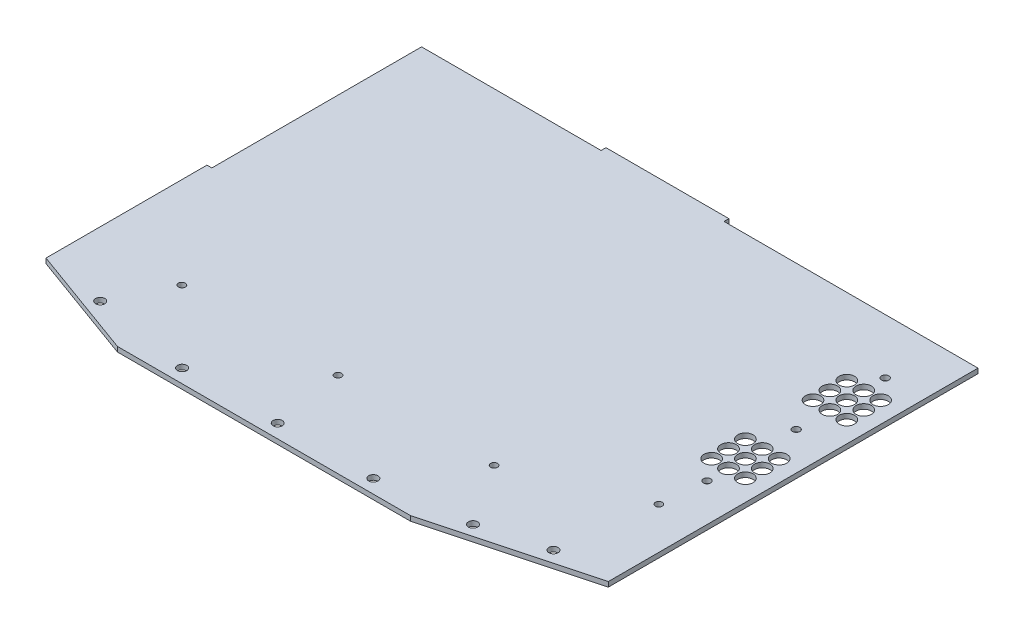
from build123d import *

# Parameters (mm, degrees)
SKETCH1_W                 = 308.11216
SKETCH1_H                 = 3.175
BOSS_EXTRUDE1_DEPTH       = 267.83
SKETCH3_W                 = 267.83
SKETCH3_H                 = 3.175
BOSS_EXTRUDE3_DEPTH       = 3.175
SKETCH4_W                 = 50.87366
SKETCH4_H                 = 3.175
BOSS_EXTRUDE4_DEPTH       = 267.83
CUT_EXTRUDE1_DEPTH        = 340.191055801
CUT_EXTRUDE3_DEPTH        = 340.191055801
SKETCH19_R                = 5
CUT_EXTRUDE5_DEPTH        = 340.191055801
LPATTERN1_COUNT           = 3
LPATTERN1_PITCH           = 11
LPATTERN2_COUNT           = 3
LPATTERN2_PITCH           = 11
LPATTERN2_COPY_1_SKETCH_R = 5
LPATTERN2_COPY_1_DEPTH    = 340.191055801
LPATTERN2_COPY_2_SKETCH_R = 5
LPATTERN2_COPY_2_DEPTH    = 340.191055801
LPATTERN2_COPY_3_SKETCH_R = 5
LPATTERN2_COPY_3_DEPTH    = 340.191055801
LPATTERN2_COPY_4_SKETCH_R = 5
LPATTERN2_COPY_4_DEPTH    = 340.191055801
LPATTERN3_COUNT           = 2
LPATTERN3_PITCH           = 66
LPATTERN3_COPY_1_SKETCH_R = 5
LPATTERN3_COPY_1_DEPTH    = 340.191055801
LPATTERN3_COPY_2_SKETCH_R = 5
LPATTERN3_COPY_2_DEPTH    = 340.191055801
LPATTERN3_COPY_3_SKETCH_R = 5
LPATTERN3_COPY_3_DEPTH    = 340.191055801
LPATTERN3_COPY_4_SKETCH_R = 5
LPATTERN3_COPY_4_DEPTH    = 340.191055801
LPATTERN3_COPY_5_SKETCH_R = 5
LPATTERN3_COPY_5_DEPTH    = 340.191055801
LPATTERN3_COPY_6_SKETCH_R = 5
LPATTERN3_COPY_6_DEPTH    = 340.191055801
LPATTERN3_COPY_7_SKETCH_R = 5
LPATTERN3_COPY_7_DEPTH    = 340.191055801
LPATTERN3_COPY_8_SKETCH_R = 5
LPATTERN3_COPY_8_DEPTH    = 340.191055801
SKETCH21_W                = 105.9343525
SKETCH21_H                = 3.175
BOSS_EXTRUDE5_DEPTH       = 3.175
CUT_EXTRUDE9_DEPTH        = 340.191055801
CUT_EXTRUDE9_DEPTH_BACK   = 340.191055801
CUT_EXTRUDE11_DEPTH       = 340.191055801
CUT_EXTRUDE11_DEPTH_BACK  = 80.645
SKETCH32_R                = 3
M4_CLEARANCE_HOLE1_D      = 4.5
SKETCH35_W                = 80
SKETCH35_H                = 3.1635
BOSS_EXTRUDE6_DEPTH       = 3.175
SKETCH36_R                = 2.4
CUT_EXTRUDE12_DEPTH       = 340.191055801
LPATTERN4_COUNT           = 3
LPATTERN4_PITCH           = 58


with BuildPart() as part:
    # Sketch1 → Boss-Extrude1 (new body)
    with BuildSketch(Plane.XY):
        Rectangle(SKETCH1_W, SKETCH1_H)
    extrude(amount=BOSS_EXTRUDE1_DEPTH)

    # Sketch3 → Boss-Extrude3 (add)
    with BuildSketch(Plane(origin=(154.05608, 0, 0), x_dir=(0, 0, -1), z_dir=(1, 0, 0))):
        with Locations((-133.915, 0)):
            Rectangle(SKETCH3_W, SKETCH3_H)
    extrude(amount=BOSS_EXTRUDE3_DEPTH)

    # Sketch4 → Boss-Extrude4 (add)
    with BuildSketch(Plane.XY.offset(267.83)):
        with Locations((182.66791, 0)):
            Rectangle(SKETCH4_W, SKETCH4_H)
    extrude(amount=-BOSS_EXTRUDE4_DEPTH)

    # Sketch6 → Cut-Extrude1 (cut, through all)
    with BuildSketch(Plane(origin=(0, 1.5875, 0), x_dir=(1, 0, 0), z_dir=(0, 1, 0))):
        Polygon((208.10474, -240.606362049), (106.50474, -267.83), (208.10474, -267.83), align=None)
    extrude(amount=-CUT_EXTRUDE1_DEPTH, mode=Mode.SUBTRACT)

    # Sketch11 → Cut-Extrude3 (cut, through all)
    with BuildSketch(Plane.XZ.offset(1.5875)):
        Polygon((-154.05608, 242.43), (-84.20608, 267.83), (-154.05608, 267.83), align=None)
    extrude(amount=-CUT_EXTRUDE3_DEPTH, mode=Mode.SUBTRACT)

    # Sketch19 → Cut-Extrude5 (cut, through all)
    with BuildSketch(Plane(origin=(0, 1.5875, 0), x_dir=(1, 0, 0), z_dir=(0, 1, 0))):
        with Locations(Location((172.48674, -49.774823778, 0), (0, 0, 270))):
            Circle(SKETCH19_R)
    cut_extrude5 = extrude(amount=-CUT_EXTRUDE5_DEPTH, mode=Mode.SUBTRACT)

    # LPattern1: Cut-Extrude5 ×3
    with Locations(*[(i * LPATTERN1_PITCH, 0, 0) for i in range(1, LPATTERN1_COUNT)]):
        add(cut_extrude5, mode=Mode.SUBTRACT)

    # LPattern2: Cut-Extrude5 ×3
    with Locations(*[(0, 0, i * LPATTERN2_PITCH) for i in range(1, LPATTERN2_COUNT)]):
        add(cut_extrude5, mode=Mode.SUBTRACT)

    # LPattern2 copy 1 sketch → LPattern2 copy 1 (cut, through all)
    with BuildSketch(Plane(origin=(11, 1.5875, 11), x_dir=(1, 0, 0), z_dir=(0, 1, 0))):
        with Locations(Location((172.48674, -49.774823778, 0), (0, 0, 270))):
            Circle(LPATTERN2_COPY_1_SKETCH_R)
    extrude(amount=-LPATTERN2_COPY_1_DEPTH, mode=Mode.SUBTRACT)

    # LPattern2 copy 2 sketch → LPattern2 copy 2 (cut, through all)
    with BuildSketch(Plane(origin=(11, 1.5875, 22), x_dir=(1, 0, 0), z_dir=(0, 1, 0))):
        with Locations(Location((172.48674, -49.774823778, 0), (0, 0, 270))):
            Circle(LPATTERN2_COPY_2_SKETCH_R)
    extrude(amount=-LPATTERN2_COPY_2_DEPTH, mode=Mode.SUBTRACT)

    # LPattern2 copy 3 sketch → LPattern2 copy 3 (cut, through all)
    with BuildSketch(Plane(origin=(22, 1.5875, 11), x_dir=(1, 0, 0), z_dir=(0, 1, 0))):
        with Locations(Location((172.48674, -49.774823778, 0), (0, 0, 270))):
            Circle(LPATTERN2_COPY_3_SKETCH_R)
    extrude(amount=-LPATTERN2_COPY_3_DEPTH, mode=Mode.SUBTRACT)

    # LPattern2 copy 4 sketch → LPattern2 copy 4 (cut, through all)
    with BuildSketch(Plane(origin=(22, 1.5875, 22), x_dir=(1, 0, 0), z_dir=(0, 1, 0))):
        with Locations(Location((172.48674, -49.774823778, 0), (0, 0, 270))):
            Circle(LPATTERN2_COPY_4_SKETCH_R)
    extrude(amount=-LPATTERN2_COPY_4_DEPTH, mode=Mode.SUBTRACT)

    # LPattern3: Cut-Extrude5 ×2
    with Locations(*[(0, 0, i * LPATTERN3_PITCH) for i in range(1, LPATTERN3_COUNT)]):
        add(cut_extrude5, mode=Mode.SUBTRACT)

    # LPattern3 copy 1 sketch → LPattern3 copy 1 (cut, through all)
    with BuildSketch(Plane(origin=(11, 1.5875, 66), x_dir=(1, 0, 0), z_dir=(0, 1, 0))):
        with Locations(Location((172.48674, -49.774823778, 0), (0, 0, 270))):
            Circle(LPATTERN3_COPY_1_SKETCH_R)
    extrude(amount=-LPATTERN3_COPY_1_DEPTH, mode=Mode.SUBTRACT)

    # LPattern3 copy 2 sketch → LPattern3 copy 2 (cut, through all)
    with BuildSketch(Plane(origin=(22, 1.5875, 66), x_dir=(1, 0, 0), z_dir=(0, 1, 0))):
        with Locations(Location((172.48674, -49.774823778, 0), (0, 0, 270))):
            Circle(LPATTERN3_COPY_2_SKETCH_R)
    extrude(amount=-LPATTERN3_COPY_2_DEPTH, mode=Mode.SUBTRACT)

    # LPattern3 copy 3 sketch → LPattern3 copy 3 (cut, through all)
    with BuildSketch(Plane(origin=(0, 1.5875, 77), x_dir=(1, 0, 0), z_dir=(0, 1, 0))):
        with Locations(Location((172.48674, -49.774823778, 0), (0, 0, 270))):
            Circle(LPATTERN3_COPY_3_SKETCH_R)
    extrude(amount=-LPATTERN3_COPY_3_DEPTH, mode=Mode.SUBTRACT)

    # LPattern3 copy 4 sketch → LPattern3 copy 4 (cut, through all)
    with BuildSketch(Plane(origin=(0, 1.5875, 88), x_dir=(1, 0, 0), z_dir=(0, 1, 0))):
        with Locations(Location((172.48674, -49.774823778, 0), (0, 0, 270))):
            Circle(LPATTERN3_COPY_4_SKETCH_R)
    extrude(amount=-LPATTERN3_COPY_4_DEPTH, mode=Mode.SUBTRACT)

    # LPattern3 copy 5 sketch → LPattern3 copy 5 (cut, through all)
    with BuildSketch(Plane(origin=(11, 1.5875, 77), x_dir=(1, 0, 0), z_dir=(0, 1, 0))):
        with Locations(Location((172.48674, -49.774823778, 0), (0, 0, 270))):
            Circle(LPATTERN3_COPY_5_SKETCH_R)
    extrude(amount=-LPATTERN3_COPY_5_DEPTH, mode=Mode.SUBTRACT)

    # LPattern3 copy 6 sketch → LPattern3 copy 6 (cut, through all)
    with BuildSketch(Plane(origin=(11, 1.5875, 88), x_dir=(1, 0, 0), z_dir=(0, 1, 0))):
        with Locations(Location((172.48674, -49.774823778, 0), (0, 0, 270))):
            Circle(LPATTERN3_COPY_6_SKETCH_R)
    extrude(amount=-LPATTERN3_COPY_6_DEPTH, mode=Mode.SUBTRACT)

    # LPattern3 copy 7 sketch → LPattern3 copy 7 (cut, through all)
    with BuildSketch(Plane(origin=(22, 1.5875, 77), x_dir=(1, 0, 0), z_dir=(0, 1, 0))):
        with Locations(Location((172.48674, -49.774823778, 0), (0, 0, 270))):
            Circle(LPATTERN3_COPY_7_SKETCH_R)
    extrude(amount=-LPATTERN3_COPY_7_DEPTH, mode=Mode.SUBTRACT)

    # LPattern3 copy 8 sketch → LPattern3 copy 8 (cut, through all)
    with BuildSketch(Plane(origin=(22, 1.5875, 88), x_dir=(1, 0, 0), z_dir=(0, 1, 0))):
        with Locations(Location((172.48674, -49.774823778, 0), (0, 0, 270))):
            Circle(LPATTERN3_COPY_8_SKETCH_R)
    extrude(amount=-LPATTERN3_COPY_8_DEPTH, mode=Mode.SUBTRACT)

    # Sketch21 → Boss-Extrude5 (add)
    with BuildSketch(Plane.ZY.offset(154.05608)):
        with Locations((189.46282375, 0)):
            Rectangle(SKETCH21_W, SKETCH21_H)
    extrude(amount=BOSS_EXTRUDE5_DEPTH)

    # Sketch27 → Cut-Extrude9 (cut, two sides: drawn at the far end of the back side and taken through both)
    with BuildSketch(Plane(origin=(0, 1.5875, 0), x_dir=(1, 0, 0), z_dir=(0, 1, 0)).offset(-CUT_EXTRUDE9_DEPTH_BACK)):
        Polygon((748.107746333, -570.489573212), (-84.20608, -267.83), (-154.05608, -242.43), (-157.23108, -241.275454545), (-989.544906333, 61.384118666), (-1594.864052757, -1603.243534), (142.788599909, -2235.117225879), align=None)
    extrude(amount=CUT_EXTRUDE9_DEPTH + CUT_EXTRUDE9_DEPTH_BACK, mode=Mode.SUBTRACT)

    # Sketch32 → Cut-Extrude11 (cut, two sides: drawn at the far end of the back side and taken through both)
    with BuildSketch(Plane(origin=(0, 1.5875, 0), x_dir=(1, 0, 0), z_dir=(0, 1, 0)).offset(-CUT_EXTRUDE11_DEPTH_BACK)):
        with Locations(Location((172.54426, -240.761310541, 0), (0, 0, 90))):
            Circle(SKETCH32_R)
        with Locations(Location((131.90426, -252.445254824, 0), (0, 0, 90))):
            Circle(SKETCH32_R)
        with Locations(Location((73.48426, -258.94, 0), (0, 0, 90))):
            Circle(SKETCH32_R)
        with Locations(Location((11.25426, -258.94, 0), (0, 0, 90))):
            Circle(SKETCH32_R)
        with Locations(Location((-50.97574, -258.94, 0), (0, 0, 90))):
            Circle(SKETCH32_R)
        with Locations(Location((-115.3206, -247.915394364, 0), (0, 0, 90))):
            Circle(SKETCH32_R)
    extrude(amount=CUT_EXTRUDE11_DEPTH + CUT_EXTRUDE11_DEPTH_BACK, mode=Mode.SUBTRACT)

    # M4 Clearance Hole1 (through all)
    with Locations(Plane(origin=(0, 1.5875, 0), x_dir=(1, 0, 0), z_dir=(0, 1, 0))):
        with Locations((180.96500002, -180.586), (105.42905, -212.2849914), (3.82905, -212.2849914), (-97.77095, -212.2849914)):
            Hole(M4_CLEARANCE_HOLE1_D / 2)

    # Sketch35 → Boss-Extrude6 (add)
    with BuildSketch(Plane(origin=(0, 0, 0), x_dir=(-1, 0, 0), z_dir=(0, 0, -1))):
        with Locations((-2.78399998, 0.00575)):
            Rectangle(SKETCH35_W, SKETCH35_H)
    extrude(amount=BOSS_EXTRUDE6_DEPTH)

    # Sketch36 → Cut-Extrude12 (cut, symmetric)
    with BuildSketch(Plane(origin=(0, 1.5875, 0), x_dir=(1, 0, 0), z_dir=(0, 1, 0))):
        with Locations(Location((183.48674, -35.774823778, 0), (0, 0, 270))):
            Circle(SKETCH36_R)
    cut_extrude12 = extrude(amount=CUT_EXTRUDE12_DEPTH, both=True, mode=Mode.SUBTRACT)

    # LPattern4: Cut-Extrude12 ×3
    with Locations(*[(0, 0, i * LPATTERN4_PITCH) for i in range(1, LPATTERN4_COUNT)]):
        add(cut_extrude12, mode=Mode.SUBTRACT)


solid = part.part
